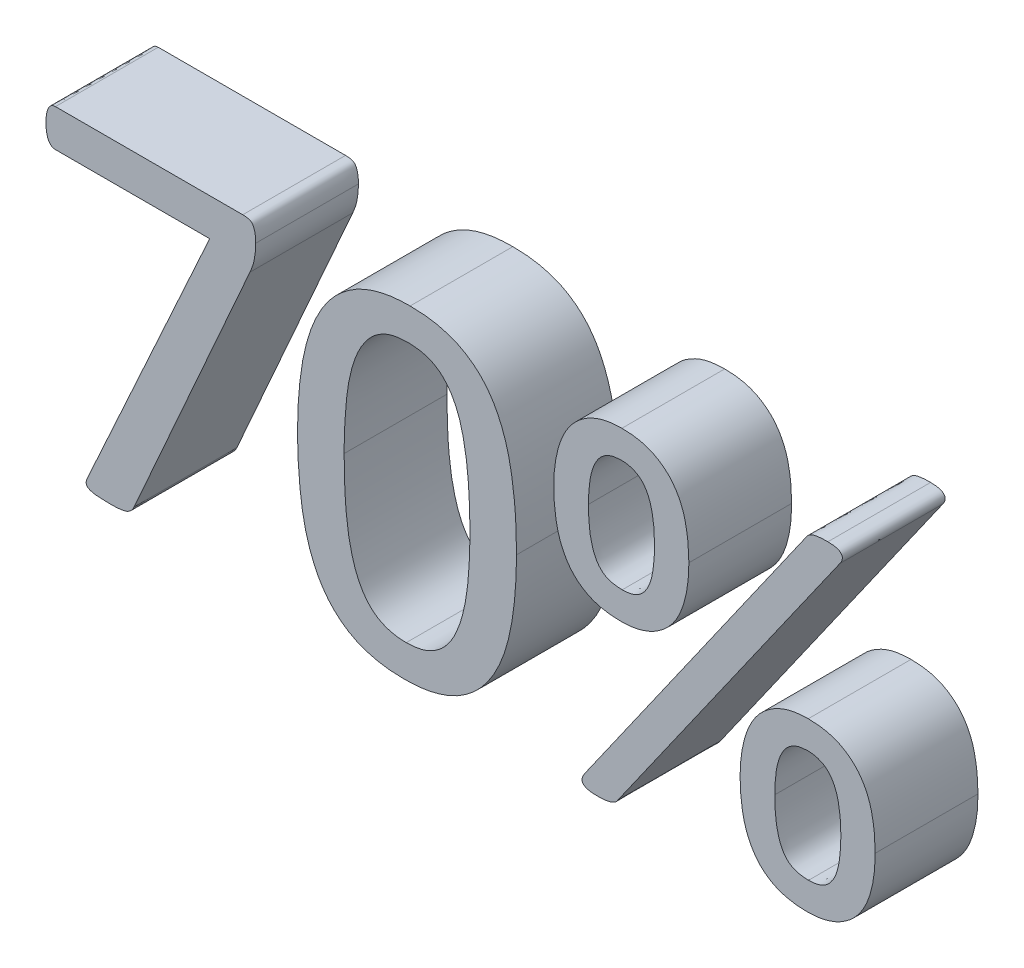
from build123d import *

# Parameters (mm, degrees)
RESSALTO_EXTRUS_O1_DEPTH   = 3
RESSALTO_EXTRUS_O1_2_DEPTH = 3
RESSALTO_EXTRUS_O1_3_DEPTH = 3
RESSALTO_EXTRUS_O1_4_DEPTH = 3
RESSALTO_EXTRUS_O1_5_DEPTH = 3


with BuildPart() as part:
    # Esboço1 → Ressalto-extrusão1 (new body)
    with BuildSketch(Plane.XY):
        with BuildLine():
            add(Edge.make_bspline(
                [(6.798490636, 8.712690656), (6.7983499, 8.671594822), (6.798082632, 8.59355109), (6.788862814, 8.481574067), (6.775999022, 8.377379473), (6.758890135, 8.278178405), (6.738722895, 8.181005578), (6.707689598, 8.088080931), (6.672844488, 7.993884846), (6.646490308, 7.931471742), (6.632777427, 7.898996308)],
                knots=[0, 0, 0, 0, 1.177443045, 2.23604289, 3.217915857, 4.185630009, 5.12130892, 6.058527683, 6.989792991, 8, 8, 8, 8], degree=3))
            Line((6.632777427, 7.898996308), (3.252652864, 0.276188682))
            add(Edge.make_bspline(
                [(3.252652864, 0.276188682), (3.240290844, 0.250043928), (3.216497064, 0.199721849), (3.164215455, 0.137042942), (3.100501767, 0.087348827), (3.022288939, 0.048205485), (2.923000556, 0.024539733), (2.802806102, 0.007914737), (2.656450144, 0.000629371), (2.550142838, 0.000222342), (2.492071724, 0)],
                knots=[0, 0, 0, 0, 0.799195828, 1.538251031, 2.237370797, 3.027593424, 3.941962922, 5.052586638, 6.38995469, 8, 8, 8, 8], degree=3))
            add(Edge.make_bspline(
                [(2.492071724, 0), (2.419147952, 0.001471205), (2.290801918, 0.004060529), (2.121546174, 0.015466418), (1.998440104, 0.042801126), (1.910154293, 0.077806586), (1.857982532, 0.135341158), (1.847934814, 0.207154062), (1.869524569, 0.282145874), (1.892900563, 0.33320721), (1.905701907, 0.361169815)],
                knots=[0, 0, 0, 0, 1.95187744, 3.435309519, 4.524282028, 5.320757332, 5.939214726, 6.496644459, 7.176720762, 8, 8, 8, 8], degree=3))
            Line((1.905701907, 0.361169815), (5.457913264, 8.158188764))
            Line((5.457913264, 8.158188764), (0.956037746, 8.158188764))
            add(Edge.make_bspline(
                [(0.956037746, 8.158188764), (0.934486795, 8.159623652), (0.891597691, 8.162479259), (0.832517789, 8.191771759), (0.783755272, 8.24002904), (0.744044372, 8.304065802), (0.714768363, 8.385192512), (0.694878044, 8.479602651), (0.681711975, 8.58839945), (0.680498674, 8.665198383), (0.679849064, 8.706317071)],
                knots=[0, 0, 0, 0, 0.756146975, 1.504827698, 2.264680289, 3.151869038, 4.14023016, 5.291926401, 6.550078386, 8, 8, 8, 8], degree=3))
            add(Edge.make_bspline(
                [(0.679849064, 8.706317071), (0.680575, 8.748834955), (0.681921894, 8.827722086), (0.693850702, 8.938333771), (0.716810294, 9.03197922), (0.74809884, 9.109927989), (0.787850593, 9.171131486), (0.837330824, 9.214005258), (0.893988825, 9.241357466), (0.9352032, 9.244406121), (0.956037746, 9.245947266)],
                knots=[0, 0, 0, 0, 1.517160829, 2.814920563, 3.961109932, 4.946717064, 5.801866421, 6.536494602, 7.260173913, 8, 8, 8, 8], degree=3))
            Line((0.956037746, 9.245947266), (6.422449123, 9.245947266))
            add(Edge.make_bspline(
                [(6.422449123, 9.245947266), (6.453727231, 9.245536652), (6.51327719, 9.24475489), (6.596094582, 9.228097686), (6.670261481, 9.198309871), (6.719480307, 9.136851311), (6.756639251, 9.061471767), (6.780015796, 8.965858504), (6.798330095, 8.84794534), (6.79843335, 8.760953878), (6.798490636, 8.712690656)],
                knots=[0, 0, 0, 0, 0.978377668, 1.862719765, 2.647750907, 3.418830465, 4.263213676, 5.276278727, 6.488868213, 8, 8, 8, 8], degree=3))
        make_face()
    extrude(amount=RESSALTO_EXTRUS_O1_DEPTH)


with BuildPart() as body_2:
    # Esboço1 → Ressalto-extrus_o1 2 (new body)
    with BuildSketch(Plane.XY):
        with BuildLine():
            add(Edge.make_bspline(
                [(14.412800149, 4.644218916), (14.410932733, 4.470656263), (14.407278453, 4.131017911), (14.373651087, 3.632823463), (14.325088676, 3.15736227), (14.25065742, 2.706849514), (14.154942778, 2.282825607), (14.029574511, 1.888165222), (13.877176714, 1.523438266), (13.696305501, 1.189332602), (13.486676547, 0.888685732), (13.24570684, 0.623267973), (12.974055817, 0.394955202), (12.671861249, 0.20076532), (12.334734642, 0.049233717), (11.962309064, -0.05864877), (11.554172275, -0.125532112), (11.269476687, -0.132406499), (11.121905776, -0.135969813)],
                knots=[0, 0, 0, 0, 1.261649291, 2.468874954, 3.628743371, 4.735003795, 5.786574978, 6.78631568, 7.741570233, 8.656225669, 9.54323609, 10.399702359, 11.254697262, 12.11591657, 13.003046518, 13.931636884, 14.927871577, 16, 16, 16, 16], degree=3))
            add(Edge.make_bspline(
                [(11.121905776, -0.135969813), (10.98214107, -0.132856135), (10.712571059, -0.126850654), (10.326576097, -0.065512793), (9.972961318, 0.028233833), (9.653351533, 0.165419032), (9.365659528, 0.340755128), (9.109336694, 0.555278118), (8.8813687, 0.804113997), (8.684626346, 1.091037964), (8.516879842, 1.41264666), (8.375234132, 1.76892143), (8.259124502, 2.159394139), (8.167663537, 2.584166811), (8.105609977, 3.043345847), (8.055267317, 3.534262882), (8.029191034, 4.057569883), (8.024587451, 4.41687124), (8.022218951, 4.60172835)],
                knots=[0, 0, 0, 0, 1.035660167, 1.997520908, 2.890630912, 3.7422618, 4.567293962, 5.38023647, 6.212888724, 7.062184684, 7.952511058, 8.897492567, 9.90101713, 10.970221115, 12.116207126, 13.335343792, 14.629059881, 16, 16, 16, 16], degree=3))
            add(Edge.make_bspline(
                [(8.022218951, 4.60172835), (8.024169626, 4.774572931), (8.027986501, 5.112776881), (8.060444865, 5.609068064), (8.113355301, 6.083368048), (8.185498388, 6.535209766), (8.285139279, 6.960607715), (8.408957736, 7.357310064), (8.562479818, 7.721980799), (8.740899705, 8.056351011), (8.948019062, 8.35872936), (9.191551587, 8.621109787), (9.460903152, 8.851896908), (9.762875588, 9.044375974), (10.099157373, 9.197765622), (10.47084595, 9.30356249), (10.877212535, 9.371808623), (11.159850949, 9.378460211), (11.30673974, 9.381917078)],
                knots=[0, 0, 0, 0, 1.258041688, 2.461602579, 3.618329998, 4.731032437, 5.790082703, 6.795960922, 7.752386136, 8.665707329, 9.550852712, 10.411847608, 11.263954598, 12.126229326, 13.009752131, 13.944426069, 14.931706538, 16, 16, 16, 16], degree=3))
            add(Edge.make_bspline(
                [(11.30673974, 9.381917078), (11.447191492, 9.378732441), (11.718129531, 9.372589127), (12.106684154, 9.312144154), (12.461038802, 9.215312156), (12.781934411, 9.078809709), (13.068609918, 8.90201843), (13.328510832, 8.69230405), (13.553308994, 8.44081686), (13.750552954, 8.155083592), (13.91814887, 7.83326108), (14.059552015, 7.476991393), (14.177061969, 7.086228848), (14.26324952, 6.660457076), (14.330709877, 6.202206238), (14.379389516, 5.711625903), (14.405927337, 5.188393408), (14.410465373, 4.82908147), (14.412800149, 4.644218916)],
                knots=[0, 0, 0, 0, 1.040017157, 2.006242029, 2.905045168, 3.755948508, 4.580275846, 5.393235391, 6.2216442, 7.070214607, 7.959780376, 8.903954588, 9.90662184, 10.97895113, 12.119525047, 13.337620206, 14.630231074, 16, 16, 16, 16], degree=3))
        make_face()
        with BuildLine():
            add(Edge.make_bspline(
                [(13.053102022, 4.557113255), (13.053135166, 4.671143049), (13.053199824, 4.893592318), (13.040945706, 5.217925544), (13.027411249, 5.524725281), (13.005340686, 5.813630172), (12.980776291, 6.085798079), (12.949195238, 6.340941191), (12.91049371, 6.578819785), (12.868753977, 6.800913571), (12.819582567, 7.007849672), (12.765207896, 7.200261562), (12.703952071, 7.378126087), (12.633654885, 7.53973012), (12.556760051, 7.687272453), (12.474095834, 7.822295318), (12.383114623, 7.943359972), (12.284352102, 8.050157238), (12.180503294, 8.145355214), (12.066603088, 8.223317581), (11.947248307, 8.290994035), (11.773553213, 8.358241577), (11.535718844, 8.418129395), (11.337637321, 8.426020085), (11.234505777, 8.430128389)],
                knots=[0, 0, 0, 0, 1.568501679, 3.059832343, 4.464345297, 5.792842069, 7.045293482, 8.223438286, 9.328550199, 10.360288933, 11.331470053, 12.25347239, 13.109998254, 13.917179394, 14.675371959, 15.397205249, 16.092790957, 16.754677627, 17.396249692, 18.025951518, 18.64951937, 19.279070459, 20.583342554, 22, 22, 22, 22], degree=3))
            add(Edge.make_bspline(
                [(11.234505777, 8.430128389), (11.142883259, 8.426424481), (10.967184195, 8.419321715), (10.716043139, 8.366177421), (10.49145153, 8.274802443), (10.295976413, 8.14375381), (10.123292443, 7.984391236), (9.975454111, 7.794228475), (9.842067273, 7.580596208), (9.730976139, 7.338514419), (9.635653832, 7.074100641), (9.560638074, 6.785551064), (9.495710179, 6.477528334), (9.453610796, 6.147699244), (9.422511728, 5.801749341), (9.399577327, 5.441856721), (9.383666501, 5.069267609), (9.382506593, 4.817031239), (9.381917078, 4.688834011)],
                knots=[0, 0, 0, 0, 0.940172863, 1.802913691, 2.621126359, 3.413609624, 4.205926117, 5.023460158, 5.878909699, 6.786352901, 7.752261332, 8.761053097, 9.844721811, 10.981943379, 12.172040428, 13.410608238, 14.683961217, 16, 16, 16, 16], degree=3))
            add(Edge.make_bspline(
                [(9.381917078, 4.688834011), (9.382960013, 4.520262151), (9.384967734, 4.195749617), (9.405170835, 3.728953502), (9.432515469, 3.300642311), (9.477739313, 2.911616903), (9.532791415, 2.558396272), (9.608338798, 2.240979911), (9.693122411, 1.955898263), (9.794992758, 1.703957178), (9.913708541, 1.486700946), (10.046458962, 1.299773099), (10.195768354, 1.145184152), (10.36208394, 1.021184292), (10.546168898, 0.929460884), (10.746425734, 0.863382132), (10.964414209, 0.821999929), (11.116050221, 0.817919972), (11.194139739, 0.815818876)],
                knots=[0, 0, 0, 0, 1.687670408, 3.248882707, 4.67752384, 5.983598817, 7.16908954, 8.254328181, 9.247933137, 10.144620704, 10.969680664, 11.721406254, 12.433426918, 13.112709074, 13.78813164, 14.483216571, 15.218886825, 16, 16, 16, 16], degree=3))
            add(Edge.make_bspline(
                [(11.194139739, 0.815818876), (11.255118429, 0.817548249), (11.373995127, 0.820919624), (11.547095121, 0.84431576), (11.709298687, 0.88382535), (11.859594157, 0.94295435), (12.0002928, 1.013894863), (12.128319355, 1.103291206), (12.248734449, 1.202675057), (12.394544403, 1.359366493), (12.55628529, 1.588509261), (12.703216676, 1.910468931), (12.82633781, 2.269201472), (12.917514635, 2.666907567), (12.985249522, 3.098563737), (13.024885213, 3.562891423), (13.047788197, 4.052651375), (13.051311419, 4.387124449), (13.053102022, 4.557113255)],
                knots=[0, 0, 0, 0, 0.625466323, 1.219333691, 1.788467372, 2.333536833, 2.872911854, 3.400863696, 3.932005007, 4.47162461, 5.592345149, 6.791446025, 8.089526683, 9.478113221, 10.971121418, 12.568779579, 14.256155412, 16, 16, 16, 16], degree=3))
        make_face(mode=Mode.SUBTRACT)
    extrude(amount=RESSALTO_EXTRUS_O1_2_DEPTH)


with BuildPart() as body_3:
    # Esboço1 → Ressalto-extrus_o1 3 (new body)
    with BuildSketch(Plane.XY):
        with BuildLine():
            add(Edge.make_bspline(
                [(19.44368322, 6.959954789), (19.441727384, 6.869276119), (19.437902053, 6.691921802), (19.417449846, 6.431290224), (19.379170107, 6.183610053), (19.326420615, 5.949174445), (19.258921867, 5.730081549), (19.175925364, 5.526254297), (19.076268115, 5.338519159), (18.959352296, 5.168169556), (18.826265066, 5.015346125), (18.67645603, 4.880470808), (18.509684219, 4.763963355), (18.328490328, 4.662329809), (18.129568263, 4.584472405), (17.91467199, 4.526242965), (17.682823954, 4.492338457), (17.522512696, 4.488812881), (17.440253011, 4.48700382)],
                knots=[0, 0, 0, 0, 1.205292075, 2.357376378, 3.471506556, 4.533200335, 5.548317663, 6.514845264, 7.453805886, 8.367521521, 9.254675681, 10.141030692, 11.039298277, 11.953450066, 12.89547173, 13.870349124, 14.907223288, 16, 16, 16, 16], degree=3))
            add(Edge.make_bspline(
                [(17.440253011, 4.48700382), (17.357275949, 4.488856181), (17.196338082, 4.49244892), (16.96450717, 4.525352099), (16.750256928, 4.574937935), (16.554549062, 4.647707018), (16.377972797, 4.741446799), (16.218193645, 4.853606861), (16.074791759, 4.983690727), (15.949155378, 5.133568687), (15.840486806, 5.301046813), (15.7467726, 5.484844239), (15.668503886, 5.685661217), (15.604249479, 5.90296338), (15.559084234, 6.138002177), (15.525539443, 6.388397081), (15.503393881, 6.654336789), (15.501519828, 6.836686649), (15.500558651, 6.930211393)],
                knots=[0, 0, 0, 0, 1.11564341, 2.163842231, 3.143566921, 4.069032583, 4.963986532, 5.825614889, 6.688821804, 7.560971938, 8.448798723, 9.369101425, 10.331488621, 11.344371911, 12.413064227, 13.547504008, 14.742148428, 16, 16, 16, 16], degree=3))
            add(Edge.make_bspline(
                [(15.500558651, 6.930211393), (15.501356601, 7.016673907), (15.50292945, 7.187101296), (15.527987224, 7.436674067), (15.563226711, 7.676712541), (15.614079936, 7.905386155), (15.678681367, 8.12288171), (15.762203905, 8.324139973), (15.857679987, 8.511533922), (15.970340768, 8.682433822), (16.101589498, 8.836389809), (16.247788261, 8.975623833), (16.413554095, 9.094937676), (16.594917878, 9.197504268), (16.793373869, 9.281049761), (17.010244725, 9.340986325), (17.244500911, 9.373830036), (17.406163153, 9.379174609), (17.489117162, 9.381917078)],
                knots=[0, 0, 0, 0, 1.159747632, 2.285993658, 3.362549339, 4.413937563, 5.427048771, 6.402973411, 7.333807451, 8.245773428, 9.142560547, 10.043417027, 10.948224761, 11.87590021, 12.834269472, 13.830299498, 14.886658042, 16, 16, 16, 16], degree=3))
            add(Edge.make_bspline(
                [(17.489117162, 9.381917078), (17.579176909, 9.379471073), (17.752281991, 9.374769573), (18.000602562, 9.339080322), (18.225613908, 9.277885549), (18.427925259, 9.191616022), (18.609184717, 9.085572209), (18.769217627, 8.9600269), (18.914851428, 8.822759817), (19.033768552, 8.662398927), (19.142582412, 8.492917801), (19.228244284, 8.305381236), (19.302308536, 8.1057343), (19.36992694, 7.815283916), (19.431233548, 7.432660642), (19.439478962, 7.119587723), (19.44368322, 6.959954789)],
                knots=[0, 0, 0, 0, 1.06459986, 2.046282073, 2.958399435, 3.813792225, 4.639532286, 5.433411152, 6.215052145, 6.99718633, 7.787125325, 8.592447053, 9.429445713, 10.300675192, 12.11374911, 14, 14, 14, 14], degree=3))
        make_face()
        with BuildLine():
            add(Edge.make_bspline(
                [(18.440905851, 6.919588751), (18.438284487, 7.045792251), (18.433334135, 7.284122965), (18.391023278, 7.618672001), (18.32556016, 7.906731666), (18.239247964, 8.111789816), (18.155032584, 8.247920222), (18.082930919, 8.333492705), (18.000033491, 8.403940158), (17.910960185, 8.465663125), (17.809669453, 8.508109098), (17.702319726, 8.544369511), (17.584613914, 8.56243816), (17.503326226, 8.564854721), (17.461498294, 8.566098202)],
                knots=[0, 0, 0, 0, 2.094609914, 3.955594539, 5.589713625, 6.985448998, 7.62484991, 8.242137001, 8.833923678, 9.42746, 10.032759793, 10.650046885, 11.305359177, 12, 12, 12, 12], degree=3))
            add(Edge.make_bspline(
                [(17.461498294, 8.566098202), (17.384362197, 8.561560478), (17.236689252, 8.552873248), (17.030685921, 8.476284155), (16.860186478, 8.344616179), (16.727509054, 8.161572362), (16.628593682, 7.931290755), (16.557605804, 7.654870374), (16.520306062, 7.328502868), (16.514786365, 7.095304477), (16.511834133, 6.970577431)],
                knots=[0, 0, 0, 0, 0.881298634, 1.687199247, 2.473936538, 3.314161325, 4.247158846, 5.32911167, 6.571465216, 8, 8, 8, 8], degree=3))
            add(Edge.make_bspline(
                [(16.511834133, 6.970577431), (16.512487142, 6.892651769), (16.513734763, 6.743768924), (16.527521052, 6.530529637), (16.544856137, 6.336638701), (16.573930645, 6.162530392), (16.614191076, 6.008045301), (16.653811959, 5.86948145), (16.706535465, 5.749415004), (16.762256574, 5.643673407), (16.830109604, 5.555892649), (16.901967917, 5.479810593), (16.983919264, 5.419250295), (17.105706451, 5.359808514), (17.278379909, 5.313016626), (17.422217959, 5.306328494), (17.497615276, 5.302822696)],
                knots=[0, 0, 0, 0, 1.479268995, 2.826254814, 4.05578099, 5.174280361, 6.172163451, 7.086568395, 7.905762241, 8.657999544, 9.34911261, 10.005201064, 10.639859841, 11.271234278, 12.569630124, 14, 14, 14, 14], degree=3))
            add(Edge.make_bspline(
                [(17.497615276, 5.302822696), (17.542363903, 5.303588513), (17.627472571, 5.305045041), (17.748206636, 5.32842603), (17.857867749, 5.35828955), (17.95579694, 5.405985741), (18.040478006, 5.469384334), (18.119538686, 5.541402762), (18.183767185, 5.630797983), (18.267373609, 5.765529709), (18.344496941, 5.968969567), (18.400600934, 6.248773553), (18.436947309, 6.569509917), (18.439535279, 6.798380387), (18.440905851, 6.919588751)],
                knots=[0, 0, 0, 0, 0.756185226, 1.438209851, 2.075565556, 2.676111349, 3.268463116, 3.862148056, 4.478405538, 5.124052033, 6.544474322, 8.127114519, 9.948944166, 12, 12, 12, 12], degree=3))
        make_face(mode=Mode.SUBTRACT)
    extrude(amount=RESSALTO_EXTRUS_O1_3_DEPTH)


with BuildPart() as body_4:
    # Esboço1 → Ressalto-extrus_o1 4 (new body)
    with BuildSketch(Plane.XY):
        with BuildLine():
            add(Edge.make_bspline(
                [(24.88247573, 2.336981156), (24.880519893, 2.246302487), (24.876694562, 2.068948169), (24.856242355, 1.808316591), (24.817962616, 1.56063642), (24.765213124, 1.326200812), (24.697714376, 1.107107916), (24.614717873, 0.903280664), (24.515060624, 0.715545526), (24.398144805, 0.545195924), (24.265057575, 0.392372492), (24.115248539, 0.257497175), (23.948476729, 0.140989722), (23.767282837, 0.039356176), (23.568360773, -0.038501228), (23.353464499, -0.096730668), (23.121616463, -0.130635176), (22.961305205, -0.134160752), (22.87904552, -0.135969813)],
                knots=[0, 0, 0, 0, 1.205292075, 2.357376378, 3.471506556, 4.533200335, 5.548317663, 6.514845264, 7.453805886, 8.367521521, 9.254675681, 10.141030692, 11.039298277, 11.953450066, 12.89547173, 13.870349124, 14.907223288, 16, 16, 16, 16], degree=3))
            add(Edge.make_bspline(
                [(22.87904552, -0.135969813), (22.796068458, -0.134117452), (22.635130591, -0.130524713), (22.403299679, -0.097621534), (22.189049437, -0.048035698), (21.993341571, 0.024733385), (21.816765306, 0.118473166), (21.656986154, 0.230633229), (21.513584268, 0.360717094), (21.387947887, 0.510595055), (21.279279315, 0.67807318), (21.18556511, 0.861870607), (21.107296395, 1.062687585), (21.043041988, 1.279989748), (20.997876743, 1.515028544), (20.964331952, 1.765423448), (20.94218639, 2.031363157), (20.940312337, 2.213713017), (20.93935116, 2.30723776)],
                knots=[0, 0, 0, 0, 1.11564341, 2.163842231, 3.143566921, 4.069032583, 4.963986532, 5.825614889, 6.688821804, 7.560971938, 8.448798723, 9.369101425, 10.331488621, 11.344371911, 12.413064227, 13.547504008, 14.742148428, 16, 16, 16, 16], degree=3))
            add(Edge.make_bspline(
                [(20.93935116, 2.30723776), (20.94014911, 2.393700275), (20.941721959, 2.564127663), (20.966779734, 2.813700434), (21.002019221, 3.053738908), (21.052872446, 3.282412523), (21.117473876, 3.499908078), (21.200996414, 3.70116634), (21.296472496, 3.888560289), (21.409133278, 4.059460189), (21.540382007, 4.213416176), (21.68658077, 4.3526502), (21.852346604, 4.471964043), (22.033710388, 4.574530635), (22.232166378, 4.658076128), (22.449037234, 4.718012692), (22.683293421, 4.750856404), (22.844955662, 4.756200976), (22.927909672, 4.758943446)],
                knots=[0, 0, 0, 0, 1.159747632, 2.285993658, 3.362549339, 4.413937563, 5.427048771, 6.402973411, 7.333807451, 8.245773428, 9.142560547, 10.043417027, 10.948224761, 11.87590021, 12.834269472, 13.830299498, 14.886658042, 16, 16, 16, 16], degree=3))
            add(Edge.make_bspline(
                [(22.927909672, 4.758943446), (23.017969419, 4.756497441), (23.1910745, 4.751795941), (23.439395071, 4.716106689), (23.664406417, 4.654911916), (23.866717768, 4.56864239), (24.047977226, 4.462598576), (24.208010136, 4.337053267), (24.353643937, 4.199786184), (24.472561062, 4.039425294), (24.581374921, 3.869944168), (24.667036794, 3.682407603), (24.741101045, 3.482760667), (24.808719449, 3.192310284), (24.870026057, 2.809687009), (24.878271471, 2.49661409), (24.88247573, 2.336981156)],
                knots=[0, 0, 0, 0, 1.06459986, 2.046282073, 2.958399435, 3.813792225, 4.639532286, 5.433411152, 6.215052145, 6.99718633, 7.787125325, 8.592447053, 9.429445713, 10.300675192, 12.11374911, 14, 14, 14, 14], degree=3))
        make_face()
        with BuildLine():
            add(Edge.make_bspline(
                [(23.879698361, 2.296615118), (23.877076996, 2.422818618), (23.872126644, 2.661149333), (23.829815787, 2.995698368), (23.76435267, 3.283758033), (23.678040473, 3.488816183), (23.593825093, 3.624946589), (23.521723429, 3.710519072), (23.438826001, 3.780966526), (23.349752695, 3.842689492), (23.248461963, 3.885135465), (23.141112235, 3.921395878), (23.023406423, 3.939464527), (22.942118735, 3.941881088), (22.900290803, 3.943124569)],
                knots=[0, 0, 0, 0, 2.094609914, 3.955594539, 5.589713625, 6.985448998, 7.62484991, 8.242137001, 8.833923678, 9.42746, 10.032759793, 10.650046885, 11.305359177, 12, 12, 12, 12], degree=3))
            add(Edge.make_bspline(
                [(22.900290803, 3.943124569), (22.823154706, 3.938586845), (22.675481761, 3.929899615), (22.46947843, 3.853310522), (22.298978987, 3.721642546), (22.166301563, 3.538598729), (22.067386192, 3.308317123), (21.996398313, 3.031896741), (21.959098571, 2.705529235), (21.953578874, 2.472330844), (21.950626643, 2.347603798)],
                knots=[0, 0, 0, 0, 0.881298634, 1.687199247, 2.473936538, 3.314161325, 4.247158846, 5.32911167, 6.571465216, 8, 8, 8, 8], degree=3))
            add(Edge.make_bspline(
                [(21.950626643, 2.347603798), (21.951279651, 2.269678136), (21.952527272, 2.120795291), (21.966313561, 1.907556004), (21.983648647, 1.713665069), (22.012723154, 1.539556759), (22.052983585, 1.385071668), (22.092604468, 1.246507817), (22.145327975, 1.126441371), (22.201049083, 1.020699775), (22.268902114, 0.932919016), (22.340760426, 0.85683696), (22.422711773, 0.796276662), (22.54449896, 0.736834882), (22.717172418, 0.690042993), (22.861010468, 0.683354862), (22.936407785, 0.679849064)],
                knots=[0, 0, 0, 0, 1.479268995, 2.826254814, 4.05578099, 5.174280361, 6.172163451, 7.086568395, 7.905762241, 8.657999544, 9.34911261, 10.005201064, 10.639859841, 11.271234278, 12.569630124, 14, 14, 14, 14], degree=3))
            add(Edge.make_bspline(
                [(22.936407785, 0.679849064), (22.981156413, 0.68061488), (23.06626508, 0.682071408), (23.186999145, 0.705452397), (23.296660258, 0.735315917), (23.394589449, 0.783012108), (23.479270515, 0.846410702), (23.558331196, 0.918429129), (23.622559694, 1.007824351), (23.706166118, 1.142556077), (23.783289451, 1.345995934), (23.839393443, 1.62579992), (23.875739819, 1.946536284), (23.878327788, 2.175406754), (23.879698361, 2.296615118)],
                knots=[0, 0, 0, 0, 0.756185226, 1.438209851, 2.075565556, 2.676111349, 3.268463116, 3.862148056, 4.478405538, 5.124052033, 6.544474322, 8.127114519, 9.948944166, 12, 12, 12, 12], degree=3))
        make_face(mode=Mode.SUBTRACT)
    extrude(amount=RESSALTO_EXTRUS_O1_4_DEPTH)


with BuildPart() as body_5:
    # Esboço1 → Ressalto-extrus_o1 5 (new body)
    with BuildSketch(Plane.XY):
        with BuildLine():
            add(Edge.make_bspline(
                [(17.372268105, -0.072233963), (17.360501048, -0.091430892), (17.337917258, -0.128274383), (17.288244907, -0.170159593), (17.229140849, -0.199784028), (17.162122568, -0.227769198), (17.081418086, -0.248858482), (16.986776211, -0.26324504), (16.873860013, -0.271559227), (16.792287344, -0.271805101), (16.747656777, -0.271939625)],
                knots=[0, 0, 0, 0, 0.783703272, 1.50411374, 2.235943224, 3.091939513, 4.041805984, 5.145965744, 6.438482292, 8, 8, 8, 8], degree=3))
            add(Edge.make_bspline(
                [(16.747656777, -0.271939625), (16.700154386, -0.271172629), (16.61445074, -0.269788818), (16.499608711, -0.250047732), (16.414831649, -0.216138342), (16.35238534, -0.174613622), (16.324718727, -0.114596994), (16.323503419, -0.047601408), (16.350435433, 0.025389113), (16.379204541, 0.073476026), (16.394985076, 0.099852831)],
                knots=[0, 0, 0, 0, 1.61676206, 2.916956319, 3.933158441, 4.723914483, 5.392411623, 6.09191921, 6.953372695, 8, 8, 8, 8], degree=3))
            Line((16.394985076, 0.099852831), (22.86629835, 9.318181229))
            add(Edge.make_bspline(
                [(22.86629835, 9.318181229), (22.879179463, 9.336357819), (22.903956903, 9.371321365), (22.951563908, 9.416744079), (23.008964579, 9.453003738), (23.080235961, 9.478065807), (23.161625483, 9.49622278), (23.256900979, 9.508806102), (23.370349577, 9.517756091), (23.453352883, 9.517840215), (23.499407791, 9.517886891)],
                knots=[0, 0, 0, 0, 0.768010129, 1.477304459, 2.257677719, 3.093569224, 4.072517501, 5.134418839, 6.410014233, 8, 8, 8, 8], degree=3))
            add(Edge.make_bspline(
                [(23.499407791, 9.517886891), (23.54557062, 9.517065271), (23.628474062, 9.515589731), (23.739948943, 9.49635962), (23.827375466, 9.467985938), (23.887097876, 9.420528441), (23.924456863, 9.361690845), (23.922609227, 9.290867811), (23.900792514, 9.21633079), (23.8692319, 9.170825452), (23.852079492, 9.146094434)],
                knots=[0, 0, 0, 0, 1.569531626, 2.818708774, 3.849156769, 4.655316742, 5.379347539, 6.127486342, 6.982335452, 8, 8, 8, 8], degree=3))
            Line((23.852079492, 9.146094434), (17.372268105, -0.072233963))
        make_face()
    extrude(amount=RESSALTO_EXTRUS_O1_5_DEPTH)


solid = Compound([part.part, body_2.part, body_3.part, body_4.part, body_5.part])
